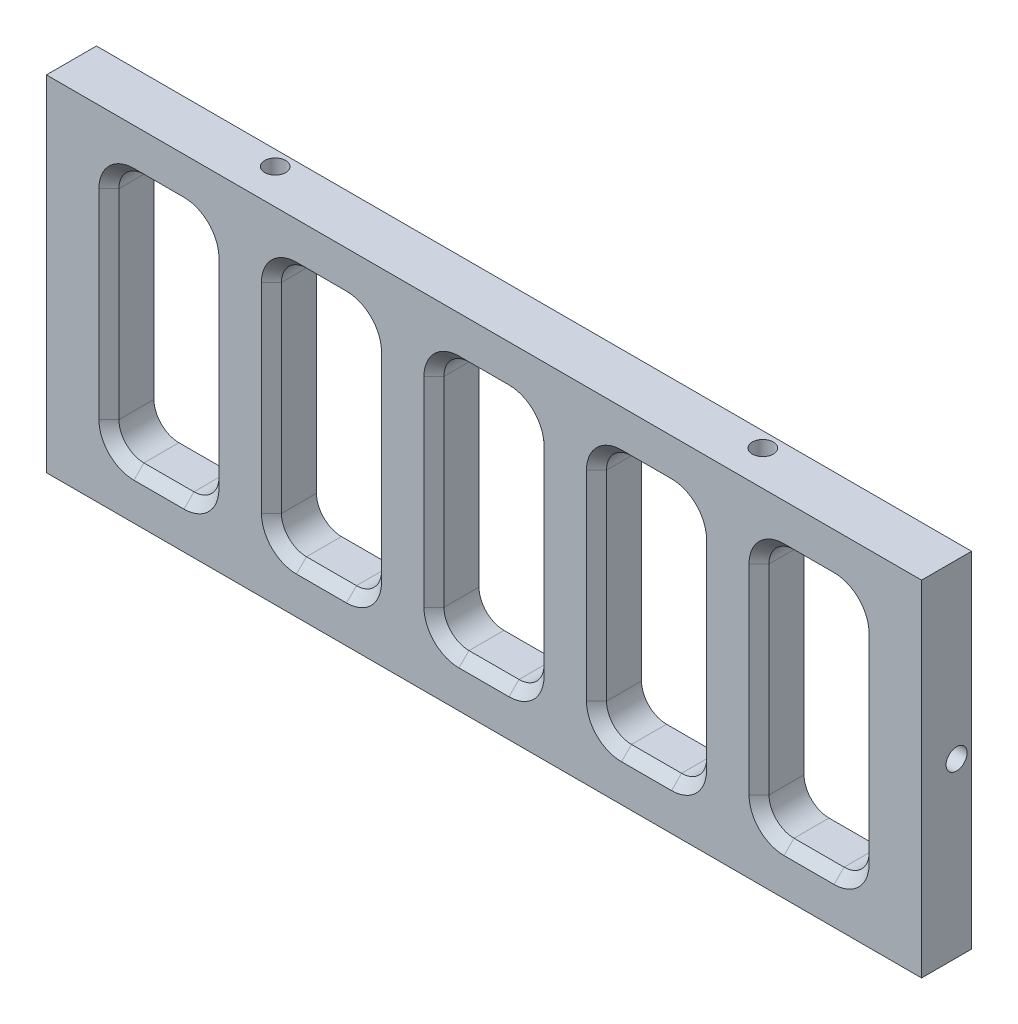
from build123d import *

# Parameters (mm, degrees)
SKETCH_1_W           = 10
SKETCH_1_H           = 68.9
EXTRUDE_1_DEPTH      = 175
CUT_EXTRUDE_1_DEPTH  = 10
CHAMFER_1_SIZE       = 2
SKETCH_5_R           = 2.1
CUT_EXTRUDE_4_DEPTH  = 6
CUT_EXTRUDE_START    = -6
SKETCH_8_R           = 2.1
CUT_EXTRUDE_7_DEPTH  = 6
CUT_EXTRUDE_8_DEPTH  = 6
SKETCH_10_R          = 2.1
CUT_EXTRUDE_10_DEPTH = 6
CUT_EXTRUDE_11_DEPTH = 1
FILLET_1_R           = 0.5


with BuildPart() as part:
    # 草图1 → 凸台-拉伸1 (new body)
    with BuildSketch(Plane(origin=(0, 0, 0), x_dir=(0, 0, -1), z_dir=(1, 0, 0))):
        Rectangle(SKETCH_1_W, SKETCH_1_H)
    extrude(amount=EXTRUDE_1_DEPTH)

    # 草图2 → 切除-拉伸1 (cut)
    with BuildSketch(Plane.XY.offset(5)):
        Polygon((65, 8.858571429), (45, 16.732857143), (45, -16.732857143), (65, -8.858571429), align=None)
        with BuildLine():
            Line((45, 20), (45, 16.732857143))
            Line((45, 16.732857143), (65, 8.858571429))
            Line((65, 8.858571429), (65, 20))
            ThreePointArc((65, 20), (63.535533906, 23.535533906), (60, 25))
            Line((60, 25), (50, 25))
            ThreePointArc((50, 25), (46.464466094, 23.535533906), (45, 20))
        make_face()
        with BuildLine():
            Line((65, -8.858571429), (45, -16.732857143))
            Line((45, -16.732857143), (45, -20))
            ThreePointArc((45, -20), (46.464466094, -23.535533906), (50, -25))
            Line((50, -25), (60, -25))
            ThreePointArc((60, -25), (63.535533906, -23.535533906), (65, -20))
            Line((65, -20), (65, -8.858571429))
        make_face()
        with BuildLine():
            Line((32.170968927, -21.783829948), (24.002177068, -25))
            Line((24.002177068, -25), (27.5, -25))
            ThreePointArc((27.5, -25), (30.335564341, -24.118200441), (32.170968927, -21.783829948))
        make_face()
        with BuildLine():
            Line((32.170968927, 21.783829948), (24.002177068, 25))
            Line((24.002177068, 25), (17.5, 25))
            ThreePointArc((17.5, 25), (13.964466094, 23.535533906), (12.5, 20))
            Line((12.5, 20), (12.5, -20))
            ThreePointArc((12.5, -20), (13.964466094, -23.535533906), (17.5, -25))
            Line((17.5, -25), (24.002177068, -25))
            Line((24.002177068, -25), (32.170968927, -21.783829948))
            ThreePointArc((32.170968927, -21.783829948), (32.417054232, -20.906960684), (32.5, -20))
            Line((32.5, -20), (32.5, 20))
            ThreePointArc((32.5, 20), (32.417054232, 20.906960684), (32.170968927, 21.783829948))
        make_face()
        with BuildLine():
            Line((27.5, 25), (24.002177068, 25))
            Line((24.002177068, 25), (32.170968927, 21.783829948))
            ThreePointArc((32.170968927, 21.783829948), (30.335564341, 24.118200441), (27.5, 25))
        make_face()
        with BuildLine():
            Line((87.5, 0), (97.5, 3.937142857))
            Line((97.5, 3.937142857), (97.5, 20))
            ThreePointArc((97.5, 20), (96.035533906, 23.535533906), (92.5, 25))
            Line((92.5, 25), (82.5, 25))
            ThreePointArc((82.5, 25), (78.964466094, 23.535533906), (77.5, 20))
            Line((77.5, 20), (77.5, 3.937142857))
            Line((77.5, 3.937142857), (87.5, 0))
        make_face()
        Polygon((77.5, -3.937142857), (87.5, 0), (77.5, 3.937142857), align=None)
        with BuildLine():
            Line((97.5, -3.937142857), (87.5, 0))
            Line((87.5, 0), (77.5, -3.937142857))
            Line((77.5, -3.937142857), (77.5, -20))
            ThreePointArc((77.5, -20), (78.964466094, -23.535533906), (82.5, -25))
            Line((82.5, -25), (92.5, -25))
            ThreePointArc((92.5, -25), (96.035533906, -23.535533906), (97.5, -20))
            Line((97.5, -20), (97.5, -3.937142857))
        make_face()
        Polygon((97.5, -3.937142857), (97.5, 3.937142857), (87.5, 0), align=None)
        Polygon((130, -16.732857143), (130, 16.732857143), (110, 8.858571429), (110, -8.858571429), align=None)
        with BuildLine():
            Line((130, -20), (130, -16.732857143))
            Line((130, -16.732857143), (110, -8.858571429))
            Line((110, -8.858571429), (110, -20))
            ThreePointArc((110, -20), (111.464466094, -23.535533906), (115, -25))
            Line((115, -25), (125, -25))
            ThreePointArc((125, -25), (128.535533906, -23.535533906), (130, -20))
        make_face()
        with BuildLine():
            Line((110, 8.858571429), (130, 16.732857143))
            Line((130, 16.732857143), (130, 20))
            ThreePointArc((130, 20), (128.535533906, 23.535533906), (125, 25))
            Line((125, 25), (115, 25))
            ThreePointArc((115, 25), (111.464466094, 23.535533906), (110, 20))
            Line((110, 20), (110, 8.858571429))
        make_face()
        with BuildLine():
            Line((157.5, 25), (150.997822932, 25))
            Line((150.997822932, 25), (142.829031073, 21.783829948))
            ThreePointArc((142.829031073, 21.783829948), (142.582945768, 20.906960684), (142.5, 20))
            Line((142.5, 20), (142.5, -20))
            ThreePointArc((142.5, -20), (142.582945768, -20.906960684), (142.829031073, -21.783829948))
            Line((142.829031073, -21.783829948), (150.997822932, -25))
            Line((150.997822932, -25), (157.5, -25))
            ThreePointArc((157.5, -25), (161.035533906, -23.535533906), (162.5, -20))
            Line((162.5, -20), (162.5, 20))
            ThreePointArc((162.5, 20), (161.035533906, 23.535533906), (157.5, 25))
        make_face()
        with BuildLine():
            Line((142.829031073, 21.783829948), (150.997822932, 25))
            Line((150.997822932, 25), (147.5, 25))
            ThreePointArc((147.5, 25), (144.664435659, 24.118200441), (142.829031073, 21.783829948))
        make_face()
        with BuildLine():
            Line((147.5, -25), (150.997822932, -25))
            Line((150.997822932, -25), (142.829031073, -21.783829948))
            ThreePointArc((142.829031073, -21.783829948), (144.664435659, -24.118200441), (147.5, -25))
        make_face()
    extrude(amount=-CUT_EXTRUDE_1_DEPTH, mode=Mode.SUBTRACT)

    # 倒角1
    chamfer_1_edges = [part.edges().sort_by_distance(p)[0] for p in [
        (46.464466094, 23.535533906, 5),
        (55, 25, 5),
        (63.535533906, 23.535533906, 5),
        (55, -25, 5),
        (143.964466094, -23.535533906, 5),
        (142.5, 0, 5),
        (143.964466094, 23.535533906, 5),
        (152.5, 25, 5),
        (161.035533906, 23.535533906, 5),
        (162.5, 0, 5),
        (161.035533906, -23.535533906, 5),
        (152.5, -25, 5),
        (130, 0, 5),
        (128.535533906, -23.535533906, 5),
        (111.464466094, -23.535533906, 5),
        (110, 0, 5),
        (111.464466094, 23.535533906, 5),
        (120, 25, 5),
        (128.535533906, 23.535533906, 5),
        (120, -25, 5),
        (77.5, 0, 5),
        (78.964466094, 23.535533906, 5),
        (87.5, 25, 5),
        (96.035533906, 23.535533906, 5),
        (97.5, 0, 5),
        (96.035533906, -23.535533906, 5),
        (78.964466094, -23.535533906, 5),
        (87.5, -25, 5),
        (31.035533906, -23.535533906, 5),
        (13.964466094, -23.535533906, 5),
        (12.5, 0, 5),
        (13.964466094, 23.535533906, 5),
        (22.5, 25, 5),
        (31.035533906, 23.535533906, 5),
        (32.5, 0, 5),
        (22.5, -25, 5),
        (65, 0, 5),
        (63.535533906, -23.535533906, 5),
        (46.464466094, -23.535533906, 5),
        (45, 0, 5),
    ]]
    chamfer(chamfer_1_edges, length=CHAMFER_1_SIZE)

    # 草图5 → 切除-拉伸4 (cut)
    with BuildSketch(Plane(origin=(0, 34.45, 0), x_dir=(1, 0, 0), z_dir=(0, 1, 0))):
        with Locations(Location((38.75, 2, 0), (0, 0, 270))):
            Circle(SKETCH_5_R)
        with Locations(Location((136.25, 2, 0), (0, 0, 270))):
            Circle(SKETCH_5_R)
    extrude(amount=-CUT_EXTRUDE_4_DEPTH, mode=Mode.SUBTRACT)

    # 草图8 → 切除-拉伸7 (cut)
    with BuildSketch(Plane.XZ.offset(34.45).offset(CUT_EXTRUDE_START)):
        with Locations(Location((136.25, -2, 0), (0, 0, 90))):
            Circle(SKETCH_8_R)
        with Locations(Location((38.75, -2, 0), (0, 0, 90))):
            Circle(SKETCH_8_R)
    extrude(amount=CUT_EXTRUDE_7_DEPTH, mode=Mode.SUBTRACT)

    # 草图9 → 切除-拉伸8 (cut)
    with BuildSketch(Plane(origin=(175, 0, 0), x_dir=(0, 0, -1), z_dir=(1, 0, 0))):
        with BuildLine():
            ThreePointArc((4.1, 0), (2, 2.1), (-0.1, 0))
            Line((-0.1, 0), (4.1, 0))
        make_face()
        with BuildLine():
            Line((4.1, 0), (-0.1, 0))
            ThreePointArc((-0.1, 0), (2, -2.1), (4.1, 0))
        make_face()
    extrude(amount=-CUT_EXTRUDE_8_DEPTH, mode=Mode.SUBTRACT)

    # 草图10 → 切除-拉伸10 (cut)
    with BuildSketch(Plane.ZY.offset(CUT_EXTRUDE_START)):
        with Locations(Location((-2, 0, 0), (0, 0, 180))):
            Circle(SKETCH_10_R)
    extrude(amount=CUT_EXTRUDE_10_DEPTH, mode=Mode.SUBTRACT)

    # 草图11 → 切除-拉伸11 (cut)
    with BuildSketch(Plane(origin=(0, 0, -5), x_dir=(-1, 0, 0), z_dir=(0, 0, -1))):
        with BuildLine():
            Line((-157.5, 30), (-17.5, 30))
            ThreePointArc((-17.5, 30), (-10.428932188, 27.071067812), (-7.5, 20))
            Line((-7.5, 20), (-7.5, -20))
            ThreePointArc((-7.5, -20), (-10.428932188, -27.071067812), (-17.5, -30))
            Line((-17.5, -30), (-157.5, -30))
            ThreePointArc((-157.5, -30), (-164.571067812, -27.071067812), (-167.5, -20))
            Line((-167.5, -20), (-167.5, 20))
            ThreePointArc((-167.5, 20), (-164.571067812, 27.071067812), (-157.5, 30))
        make_face()
    extrude(amount=-CUT_EXTRUDE_11_DEPTH, mode=Mode.SUBTRACT)

    # 圆角1
    fillet_1_edges = [part.edges().sort_by_distance(p)[0] for p in [
        (10.428932188, -27.071067812, -5),
        (7.5, 0, -5),
        (10.428932188, 27.071067812, -5),
        (87.5, 30, -5),
        (164.571067812, 27.071067812, -5),
        (167.5, 0, -5),
        (164.571067812, -27.071067812, -5),
        (87.5, -30, -5),
    ]]
    fillet(fillet_1_edges, radius=FILLET_1_R)


solid = part.part
